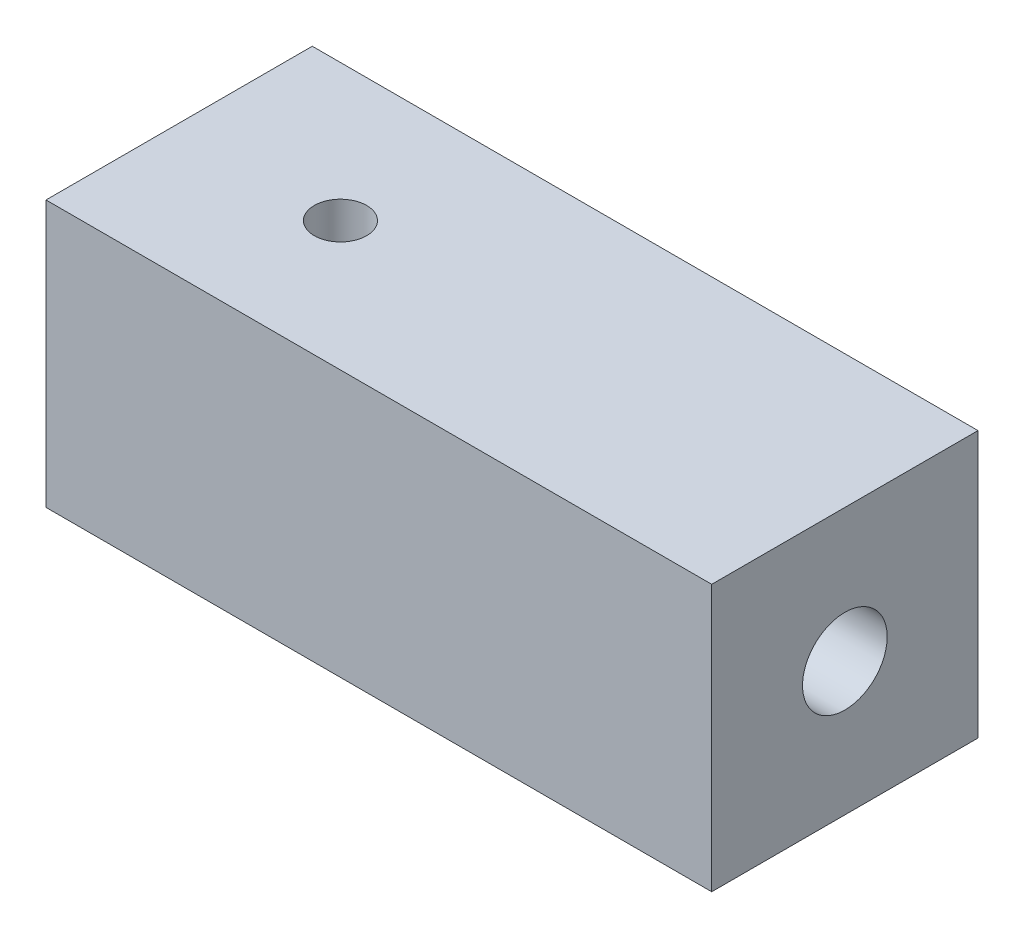
from build123d import *

# Parameters (mm, degrees)
SKETCH1_W                  = 12.7
SKETCH1_H                  = 12.7
BOSS_EXTRUDE1_DEPTH        = 31.75
F_10_32_TAPPED_HOLE1_D     = 4.0386
F_10_32_TAPPED_HOLE1_DEPTH = 11.938
F_10_32_TAPPED_HOLE1_TIP   = 1.213317848
M3X0_5_TAPPED_HOLE1_D      = 2.5


with BuildPart() as part:
    # Sketch1 → Boss-Extrude1 (new body)
    with BuildSketch(Plane(origin=(0, 0, 0), x_dir=(0, 0, -1), z_dir=(1, 0, 0))):
        with Locations((6.35, 6.35)):
            Rectangle(SKETCH1_W, SKETCH1_H)
    extrude(amount=BOSS_EXTRUDE1_DEPTH)

    # #10-32 Tapped Hole1
    with Locations(Plane(origin=(31.75, 0.23991288, -27.515191368), x_dir=(0, 0, 1), z_dir=(1, 0, 0))):
        with Locations((21.165191368, -6.11008712)):
            Hole(F_10_32_TAPPED_HOLE1_D / 2, depth=F_10_32_TAPPED_HOLE1_DEPTH)
            with Locations((0, 0, -(F_10_32_TAPPED_HOLE1_DEPTH + F_10_32_TAPPED_HOLE1_TIP / 2))):  # 118° drill point
                Cone(0, F_10_32_TAPPED_HOLE1_D / 2, F_10_32_TAPPED_HOLE1_TIP, mode=Mode.SUBTRACT)

    # M3x0.5 Tapped Hole1 (through all)
    with Locations(Plane(origin=(0.397447268, 0, -0.674798578), x_dir=(1, 0, 0), z_dir=(0, -1, 0))):
        with Locations((7.476552732, -5.495536137)):
            Hole(M3X0_5_TAPPED_HOLE1_D / 2)


solid = part.part
